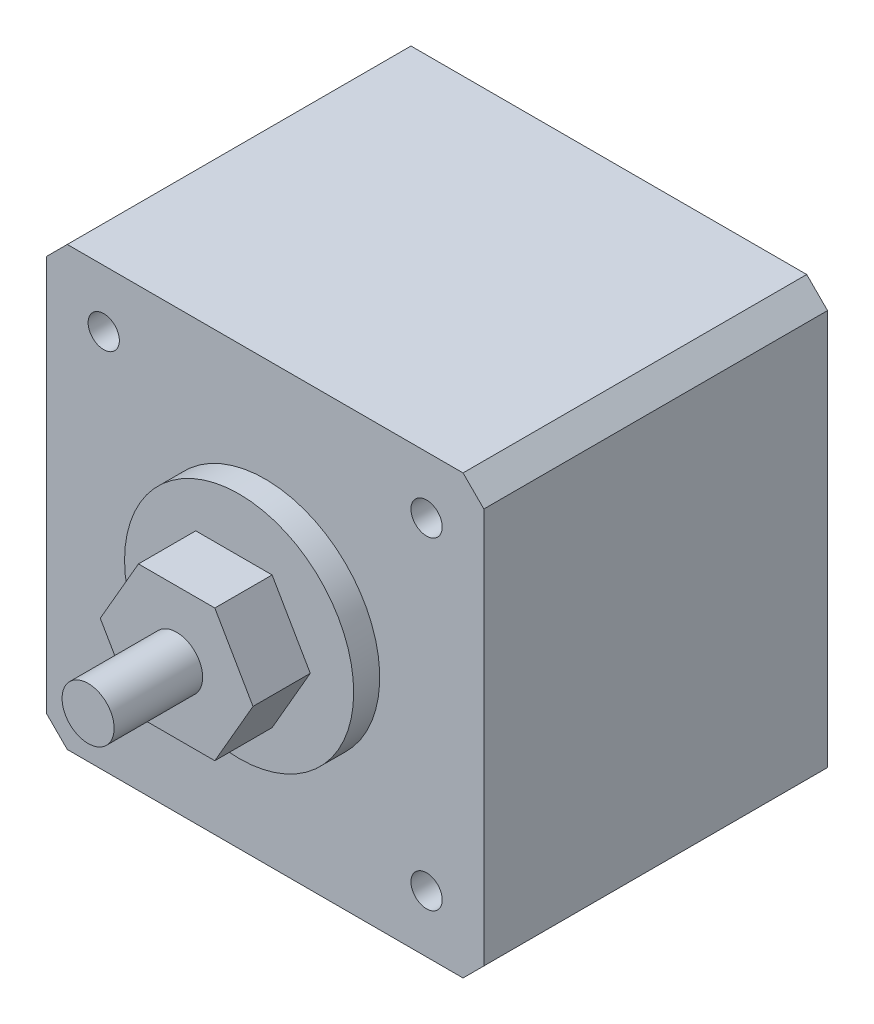
from build123d import *

# Parameters (mm, degrees)
EXTRUDE1_DEPTH      = 33
SKETCH2_R           = 1.5
EXTRUDE2_DEPTH      = 43
SKETCH3_R           = 11
EXTRUDE3_DEPTH      = 2.5
EXTRUDE4_DEPTH      = 14.5
EXTRUDE4_DEPTH_BACK = 37
SKETCH4_R           = 2.5
BOSS_EXTRUDE1_START = 0.5
BOSS_EXTRUDE1_DEPTH = 5.5


with BuildPart() as part:
    # Sketch1 → Extrude1 (new body)
    with BuildSketch(Plane.XY):
        Polygon((-21, 19), (-19, 21), (19, 21), (21, 19), (21, -19), (19, -21), (-19, -21), (-21, -19), align=None)
    extrude(amount=EXTRUDE1_DEPTH)

    # Sketch2 → Extrude2 (cut)
    with BuildSketch(Plane.XY.offset(33)):
        with Locations((-15.5, 15.5)):
            Circle(SKETCH2_R)
        with Locations((15.5, 15.5)):
            Circle(SKETCH2_R)
        with Locations((-15.5, -15.5)):
            Circle(SKETCH2_R)
        with Locations((15.5, -15.5)):
            Circle(SKETCH2_R)
    extrude(amount=-EXTRUDE2_DEPTH, mode=Mode.SUBTRACT)

    # Sketch3 → Extrude3 (add)
    with BuildSketch(Plane.XY.offset(33)):
        with Locations(Location((0, 0, 0), (0, 0, 180))):
            Circle(SKETCH3_R)
    extrude(amount=EXTRUDE3_DEPTH)

    # Sketch4 → Extrude4 (add, two sides: drawn at the far end of the back side and taken through both)
    with BuildSketch(Plane.XY.offset(35.5).offset(-EXTRUDE4_DEPTH_BACK)):
        Circle(SKETCH4_R)
    extrude(amount=EXTRUDE4_DEPTH + EXTRUDE4_DEPTH_BACK)

    # Sketch5 → Boss-Extrude1 (add)
    with BuildSketch(Plane.XY.offset(35.5).offset(BOSS_EXTRUDE1_START)):
        Polygon((7.332348419, 0), (3.666174209, 6.35), (-3.666174209, 6.35), (-7.332348419, 0), (-3.666174209, -6.35), (3.666174209, -6.35), align=None)
    extrude(amount=BOSS_EXTRUDE1_DEPTH)


solid = part.part
